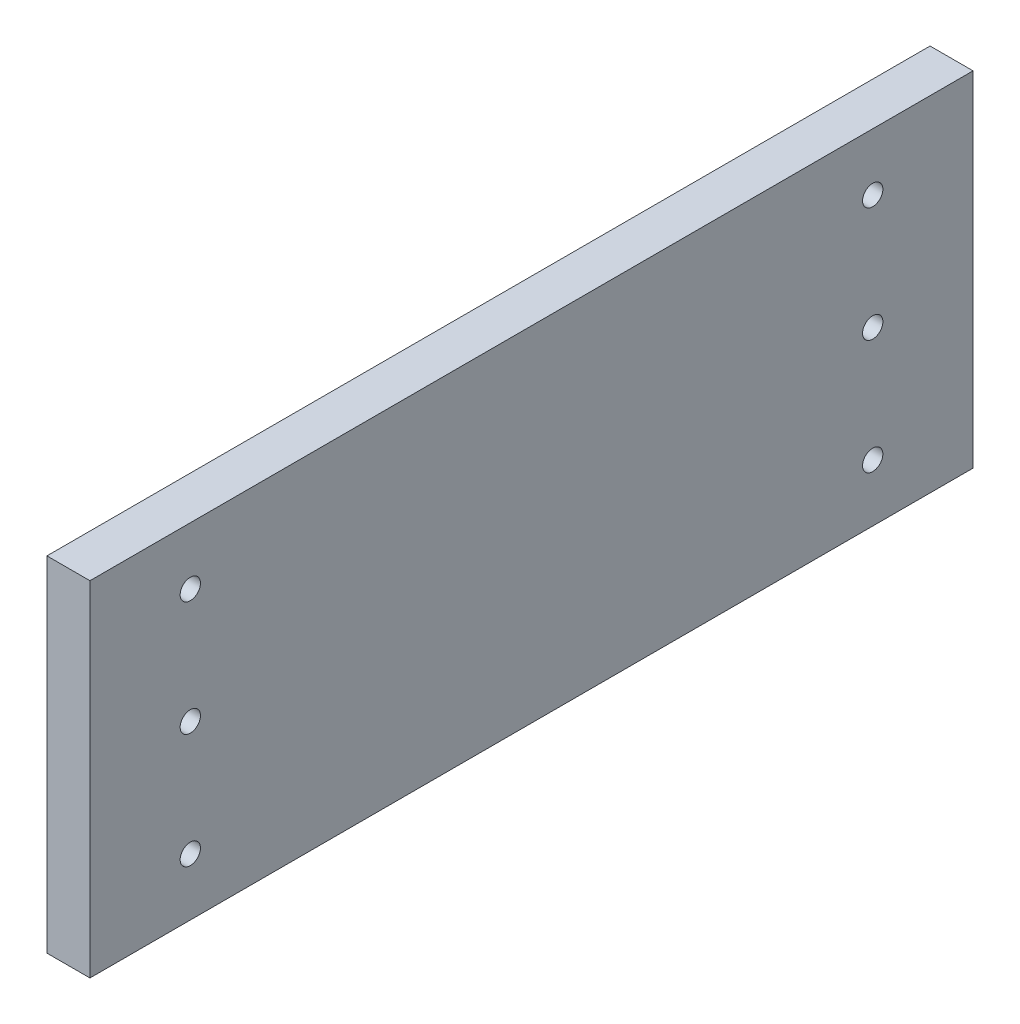
from build123d import *

# Parameters (mm, degrees)
SKETCH1_W             = 9.525
SKETCH1_H             = 76.2
BOSS_EXTRUDE1_DEPTH   = 195.58
F_8_CLEARANCE_HOLE1_D = 4.4958


with BuildPart() as part:
    # Sketch1 → Boss-Extrude1 (new body)
    with BuildSketch(Plane.XY):
        Rectangle(SKETCH1_W, SKETCH1_H)
    extrude(amount=BOSS_EXTRUDE1_DEPTH)

    # #8 Clearance Hole1 (through all)
    with Locations(Plane(origin=(4.7625, 0, 0), x_dir=(0, 0, -1), z_dir=(1, 0, 0))):
        with Locations((-173.355, 25.4), (-173.355, 0), (-173.355, -25.4), (-22.225, 25.4), (-22.225, 0), (-22.225, -25.4)):
            Hole(F_8_CLEARANCE_HOLE1_D / 2)


solid = part.part
